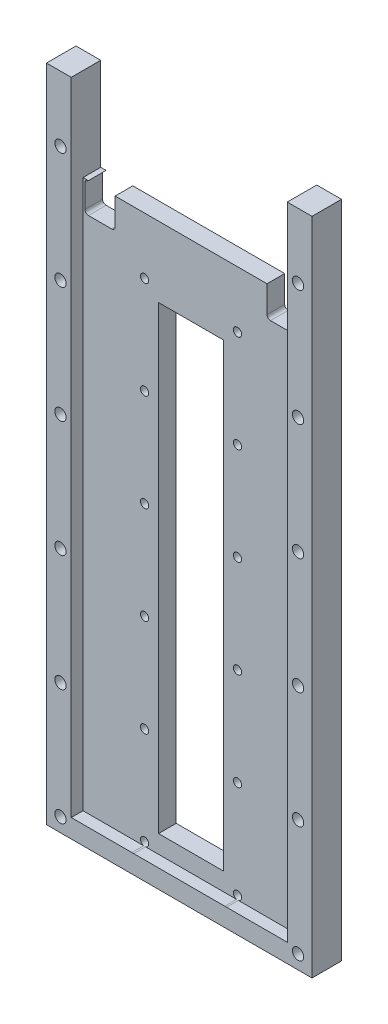
from build123d import *

# Parameters (mm, degrees)
SKETCH1_W                 = 57.15
SKETCH1_H                 = 142.494
BOSS_EXTRUDE1_DEPTH       = 6.35
SKETCH2_W                 = 14
SKETCH2_H                 = 99
CUT_EXTRUDE1_DEPTH        = 78.025892621
SKETCH3_R                 = 1.2192
CUT_EXTRUDE2_DEPTH        = 78.025892621
LPATTERN1_COUNT           = 6
LPATTERN1_PITCH           = 25
LPATTERN1_COPY_1_SKETCH_R = 1.2192
LPATTERN1_COPY_1_DEPTH    = 78.025892621
LPATTERN1_COPY_2_SKETCH_R = 1.2192
LPATTERN1_COPY_2_DEPTH    = 78.025892621
LPATTERN1_COPY_3_SKETCH_R = 1.2192
LPATTERN1_COPY_3_DEPTH    = 78.025892621
LPATTERN1_COPY_4_SKETCH_R = 1.2192
LPATTERN1_COPY_4_DEPTH    = 78.025892621
LPATTERN1_COPY_5_SKETCH_R = 1.2192
LPATTERN1_COPY_5_DEPTH    = 78.025892621
SKETCH4_R                 = 0.889
CUT_EXTRUDE3_DEPTH        = 78.025892621
LPATTERN2_COUNT           = 6
LPATTERN2_PITCH           = 21
LPATTERN2_COPY_1_SKETCH_R = 0.889
LPATTERN2_COPY_1_DEPTH    = 78.025892621
LPATTERN2_COPY_2_SKETCH_R = 0.889
LPATTERN2_COPY_2_DEPTH    = 78.025892621
LPATTERN2_COPY_3_SKETCH_R = 0.889
LPATTERN2_COPY_3_DEPTH    = 78.025892621
LPATTERN2_COPY_4_SKETCH_R = 0.889
LPATTERN2_COPY_4_DEPTH    = 78.025892621
LPATTERN2_COPY_5_SKETCH_R = 0.889
LPATTERN2_COPY_5_DEPTH    = 78.025892621
SKETCH6_W                 = 41.91
SKETCH6_H                 = 10.16
CUT_EXTRUDE4_DEPTH        = 78.025892621
SKETCH8_W                 = 46.5
SKETCH8_H                 = 152.4
CUT_EXTRUDE6_DEPTH        = 2.54
SKETCH9_W                 = 57.15
SKETCH9_H                 = 6.35
CUT_EXTRUDE7_DEPTH        = 0.5
SKETCH11_W                = 6.5
SKETCH11_H                = 6.5
CUT_EXTRUDE8_DEPTH        = 78.025892621
FILLET1_R                 = 0.75
FILLET1_OF_MIRROR4_R      = 0.75
SKETCH12_W                = 41.91
SKETCH12_H                = 9.793222615
CUT_EXTRUDE9_DEPTH        = 77.858192368
SKETCH13_W                = 46.5
SKETCH13_H                = 19.953222615
CUT_EXTRUDE10_DEPTH       = 77.858192368


with BuildPart() as part:
    # Sketch1 → Boss-Extrude1 (new body)
    with BuildSketch(Plane.XY):
        Rectangle(SKETCH1_W, SKETCH1_H)
    extrude(amount=BOSS_EXTRUDE1_DEPTH)

    # Sketch2 → Cut-Extrude1 (cut, through all)
    with BuildSketch(Plane.XY.offset(6.35)):
        with Locations((0, -13.879757445)):
            Rectangle(SKETCH2_W, SKETCH2_H)
    extrude(amount=-CUT_EXTRUDE1_DEPTH, mode=Mode.SUBTRACT)

    # Sketch3 → Cut-Extrude2 (cut, through all)
    with BuildSketch(Plane.XY.offset(6.35)):
        with Locations((-25.575, -68.247)):
            Circle(SKETCH3_R)
    cut_extrude2 = extrude(amount=-CUT_EXTRUDE2_DEPTH, mode=Mode.SUBTRACT)

    # Mirror1: Cut-Extrude2 across plane
    add(cut_extrude2.mirror(Plane(origin=(0, 0, 0), x_dir=(0, 0, 1), z_dir=(1, 0, 0))), mode=Mode.SUBTRACT)

    # LPattern1: Cut-Extrude2 ×6
    with Locations(*[(0, i * LPATTERN1_PITCH, 0) for i in range(1, LPATTERN1_COUNT)]):
        add(cut_extrude2, mode=Mode.SUBTRACT)

    # LPattern1 copy 1 sketch → LPattern1 copy 1 (cut, through all)
    with BuildSketch(Plane(origin=(0, 25, 6.35), x_dir=(-1, 0, 0), z_dir=(0, 0, 1))):
        with Locations((-25.575, 68.247)):
            Circle(LPATTERN1_COPY_1_SKETCH_R)
    extrude(amount=-LPATTERN1_COPY_1_DEPTH, mode=Mode.SUBTRACT)

    # LPattern1 copy 2 sketch → LPattern1 copy 2 (cut, through all)
    with BuildSketch(Plane(origin=(0, 50, 6.35), x_dir=(-1, 0, 0), z_dir=(0, 0, 1))):
        with Locations((-25.575, 68.247)):
            Circle(LPATTERN1_COPY_2_SKETCH_R)
    extrude(amount=-LPATTERN1_COPY_2_DEPTH, mode=Mode.SUBTRACT)

    # LPattern1 copy 3 sketch → LPattern1 copy 3 (cut, through all)
    with BuildSketch(Plane(origin=(0, 75, 6.35), x_dir=(-1, 0, 0), z_dir=(0, 0, 1))):
        with Locations((-25.575, 68.247)):
            Circle(LPATTERN1_COPY_3_SKETCH_R)
    extrude(amount=-LPATTERN1_COPY_3_DEPTH, mode=Mode.SUBTRACT)

    # LPattern1 copy 4 sketch → LPattern1 copy 4 (cut, through all)
    with BuildSketch(Plane(origin=(0, 100, 6.35), x_dir=(-1, 0, 0), z_dir=(0, 0, 1))):
        with Locations((-25.575, 68.247)):
            Circle(LPATTERN1_COPY_4_SKETCH_R)
    extrude(amount=-LPATTERN1_COPY_4_DEPTH, mode=Mode.SUBTRACT)

    # LPattern1 copy 5 sketch → LPattern1 copy 5 (cut, through all)
    with BuildSketch(Plane(origin=(0, 125, 6.35), x_dir=(-1, 0, 0), z_dir=(0, 0, 1))):
        with Locations((-25.575, 68.247)):
            Circle(LPATTERN1_COPY_5_SKETCH_R)
    extrude(amount=-LPATTERN1_COPY_5_DEPTH, mode=Mode.SUBTRACT)

    # Sketch4 → Cut-Extrude3 (cut, through all)
    with BuildSketch(Plane.XY.offset(6.35)):
        with Locations((-10, -66.379757445)):
            Circle(SKETCH4_R)
    cut_extrude3 = extrude(amount=-CUT_EXTRUDE3_DEPTH, mode=Mode.SUBTRACT)

    # Mirror2: Cut-Extrude3 across plane
    add(cut_extrude3.mirror(Plane(origin=(0, 0, 0), x_dir=(0, 0, 1), z_dir=(1, 0, 0))), mode=Mode.SUBTRACT)

    # LPattern2: Cut-Extrude3 ×6
    with Locations(*[(0, i * LPATTERN2_PITCH, 0) for i in range(1, LPATTERN2_COUNT)]):
        add(cut_extrude3, mode=Mode.SUBTRACT)

    # LPattern2 copy 1 sketch → LPattern2 copy 1 (cut, through all)
    with BuildSketch(Plane(origin=(0, 21, 6.35), x_dir=(-1, 0, 0), z_dir=(0, 0, 1))):
        with Locations((-10, 66.379757445)):
            Circle(LPATTERN2_COPY_1_SKETCH_R)
    extrude(amount=-LPATTERN2_COPY_1_DEPTH, mode=Mode.SUBTRACT)

    # LPattern2 copy 2 sketch → LPattern2 copy 2 (cut, through all)
    with BuildSketch(Plane(origin=(0, 42, 6.35), x_dir=(-1, 0, 0), z_dir=(0, 0, 1))):
        with Locations((-10, 66.379757445)):
            Circle(LPATTERN2_COPY_2_SKETCH_R)
    extrude(amount=-LPATTERN2_COPY_2_DEPTH, mode=Mode.SUBTRACT)

    # LPattern2 copy 3 sketch → LPattern2 copy 3 (cut, through all)
    with BuildSketch(Plane(origin=(0, 63, 6.35), x_dir=(-1, 0, 0), z_dir=(0, 0, 1))):
        with Locations((-10, 66.379757445)):
            Circle(LPATTERN2_COPY_3_SKETCH_R)
    extrude(amount=-LPATTERN2_COPY_3_DEPTH, mode=Mode.SUBTRACT)

    # LPattern2 copy 4 sketch → LPattern2 copy 4 (cut, through all)
    with BuildSketch(Plane(origin=(0, 84, 6.35), x_dir=(-1, 0, 0), z_dir=(0, 0, 1))):
        with Locations((-10, 66.379757445)):
            Circle(LPATTERN2_COPY_4_SKETCH_R)
    extrude(amount=-LPATTERN2_COPY_4_DEPTH, mode=Mode.SUBTRACT)

    # LPattern2 copy 5 sketch → LPattern2 copy 5 (cut, through all)
    with BuildSketch(Plane(origin=(0, 105, 6.35), x_dir=(-1, 0, 0), z_dir=(0, 0, 1))):
        with Locations((-10, 66.379757445)):
            Circle(LPATTERN2_COPY_5_SKETCH_R)
    extrude(amount=-LPATTERN2_COPY_5_DEPTH, mode=Mode.SUBTRACT)

    # Sketch6 → Cut-Extrude4 (cut, through all)
    with BuildSketch(Plane.XY.offset(6.35)):
        with Locations((0, 55.873777385)):
            Rectangle(SKETCH6_W, SKETCH6_H)
    extrude(amount=-CUT_EXTRUDE4_DEPTH, mode=Mode.SUBTRACT)

    # Sketch8 → Cut-Extrude6 (cut)
    with BuildSketch(Plane.XY.offset(6.35)):
        with Locations((0, 8.953)):
            Rectangle(SKETCH8_W, SKETCH8_H)
    extrude(amount=-CUT_EXTRUDE6_DEPTH, mode=Mode.SUBTRACT)

    # Sketch9 → Cut-Extrude7 (cut)
    with BuildSketch(Plane(origin=(0, 71.247, 0), x_dir=(1, 0, 0), z_dir=(0, 1, 0))):
        with Locations((0, -3.175)):
            Rectangle(SKETCH9_W, SKETCH9_H)
    extrude(amount=-CUT_EXTRUDE7_DEPTH, mode=Mode.SUBTRACT)

    # Sketch11 → Cut-Extrude8 (cut, through all)
    with BuildSketch(Plane(origin=(0, 0, 0), x_dir=(-1, 0, 0), z_dir=(0, 0, -1))):
        with Locations((-19.6, 47.543777385)):
            Rectangle(SKETCH11_W, SKETCH11_H)
    cut_extrude8 = extrude(amount=-CUT_EXTRUDE8_DEPTH, mode=Mode.SUBTRACT)

    # Fillet1
    fillet1_edges = [part.edges().sort_by_distance(p)[0] for p in [
        (16.35, 44.293777385, 1.905),
        (22.85, 44.293777385, 1.905),
        (22.85, 50.793777385, 1.905),
    ]]
    fillet(fillet1_edges, radius=FILLET1_R)

    # Mirror4: Cut-Extrude8 across plane
    add(cut_extrude8.mirror(Plane(origin=(0, 0, 0), x_dir=(0, 0, 1), z_dir=(1, 0, 0))), mode=Mode.SUBTRACT)

    # Fillet1 of Mirror4
    fillet1_of_mirror4_edges = [part.edges().sort_by_distance(p)[0] for p in [
        (-16.35, 44.293777385, 1.905),
        (-22.85, 44.293777385, 1.905),
        (-22.85, 50.793777385, 1.905),
    ]]
    fillet(fillet1_of_mirror4_edges, radius=FILLET1_OF_MIRROR4_R)

    # Sketch12 → Cut-Extrude9 (cut, through all)
    with BuildSketch(Plane.XY.offset(3.81)):
        with Locations((0, 65.850388693)):
            Rectangle(SKETCH12_W, SKETCH12_H)
    extrude(amount=-CUT_EXTRUDE9_DEPTH, mode=Mode.SUBTRACT)

    # Sketch13 → Cut-Extrude10 (cut, through all)
    with BuildSketch(Plane.XY.offset(3.81)):
        with Locations((0, 60.770388693)):
            Rectangle(SKETCH13_W, SKETCH13_H)
    extrude(amount=-CUT_EXTRUDE10_DEPTH, mode=Mode.SUBTRACT)


solid = part.part
